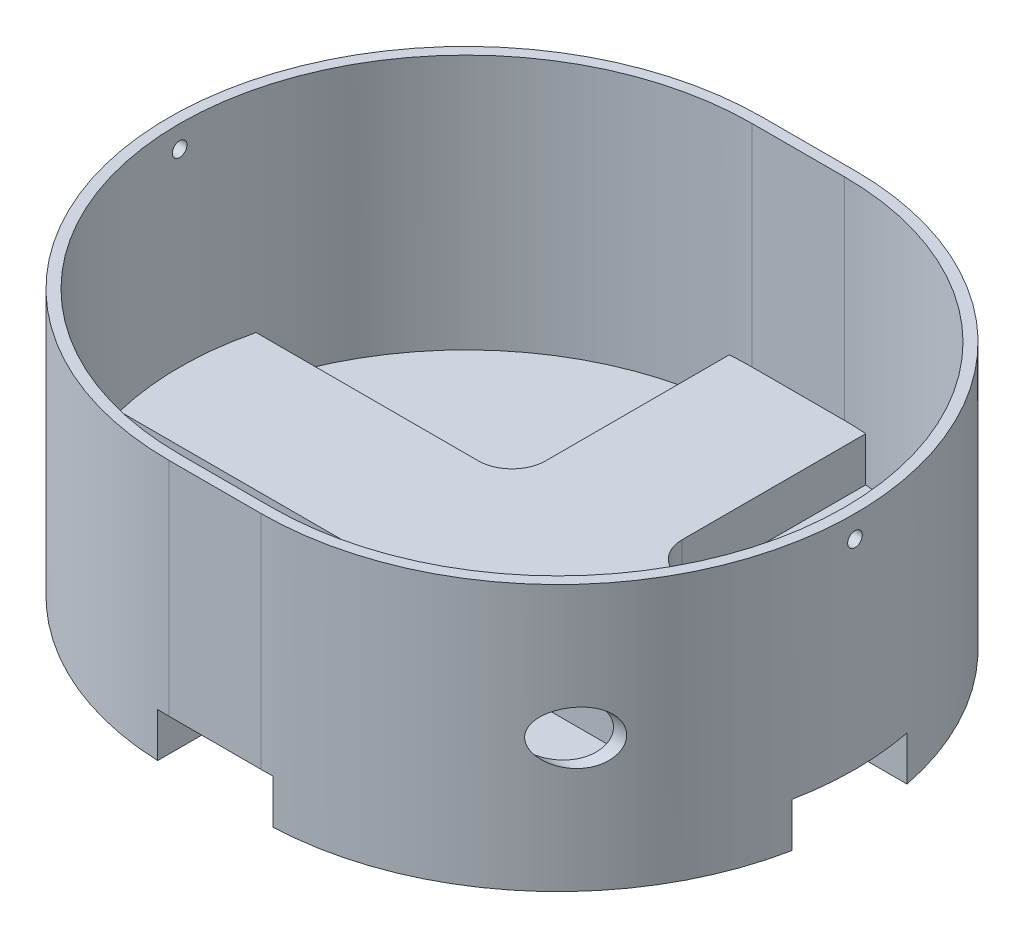
from build123d import *

# Parameters (mm, degrees)
BOSS_EXTRUDE1_DEPTH     = 60
CUT_EXTRUDE1_DEPTH      = 10
FILLET1_R               = 10
SHELL1_T                = -2.4
CUT_EXTRUDE2_DEPTH      = 119.658164489
CUT_EXTRUDE2_DEPTH_BACK = 119.658164489
SKETCH3_R               = 1.65
SKETCH4_R               = 6
CUT_EXTRUDE3_DEPTH      = 119.658164667


with BuildPart() as part:
    # Sketch1 → Boss-Extrude1 (new body)
    with BuildSketch(Plane(origin=(0, 0, 0), x_dir=(1, 0, 0), z_dir=(0, 1, 0))):
        with BuildLine():
            Line((-10.4, 67), (10.4, 67))
            ThreePointArc((10.4, 67), (77.4, 0), (10.4, -67))
            Line((10.4, -67), (-10.4, -67))
            ThreePointArc((-10.4, -67), (-77.4, 0), (-10.4, 67))
        make_face()
    extrude(amount=BOSS_EXTRUDE1_DEPTH)

    # Sketch2 → Cut-Extrude1 (cut)
    with BuildSketch(Plane.XZ):
        Polygon((-91.251700072, 13), (-13, 13), (-13, 91.251700072), (13, 91.251700072), (13, 13), (91.251700072, 13), (91.251700072, -13), (13, -13), (13, -91.251700072), (-13, -91.251700072), (-13, -13), (-91.251700072, -13), align=None)
    extrude(amount=-CUT_EXTRUDE1_DEPTH, mode=Mode.SUBTRACT)

    # Fillet1
    fillet1_edges = [part.edges().sort_by_distance(p)[0] for p in [
        (-13, 5, 13),
        (13, 5, 13),
        (13, 5, -13),
        (-13, 5, -13),
    ]]
    fillet(fillet1_edges, radius=FILLET1_R)

    # Shell1
    shell1_openings = [part.faces().sort_by_distance(p)[0] for p in [
        (0, 60, 0),
    ]]
    offset(amount=SHELL1_T, openings=shell1_openings, kind=Kind.INTERSECTION)

    # Sketch3 → Cut-Extrude2 (cut, two sides: drawn at the far end of the back side and taken through both)
    with BuildSketch(Plane(origin=(0, 0, 0), x_dir=(0, 0, -1), z_dir=(1, 0, 0)).offset(-CUT_EXTRUDE2_DEPTH_BACK)):
        with Locations((0, 55)):
            Circle(SKETCH3_R)
    extrude(amount=CUT_EXTRUDE2_DEPTH + CUT_EXTRUDE2_DEPTH_BACK, mode=Mode.SUBTRACT)

    # Sketch4 → Cut-Extrude3 (cut, through all)
    with BuildSketch(Plane(origin=(0, 0, 0), x_dir=(0, 0, -1), z_dir=(1, 0, 0))):
        with Locations(Location((-45, 30, 0), (0, 0, 180))):
            Circle(SKETCH4_R)
    extrude(amount=CUT_EXTRUDE3_DEPTH, mode=Mode.SUBTRACT)


solid = part.part
